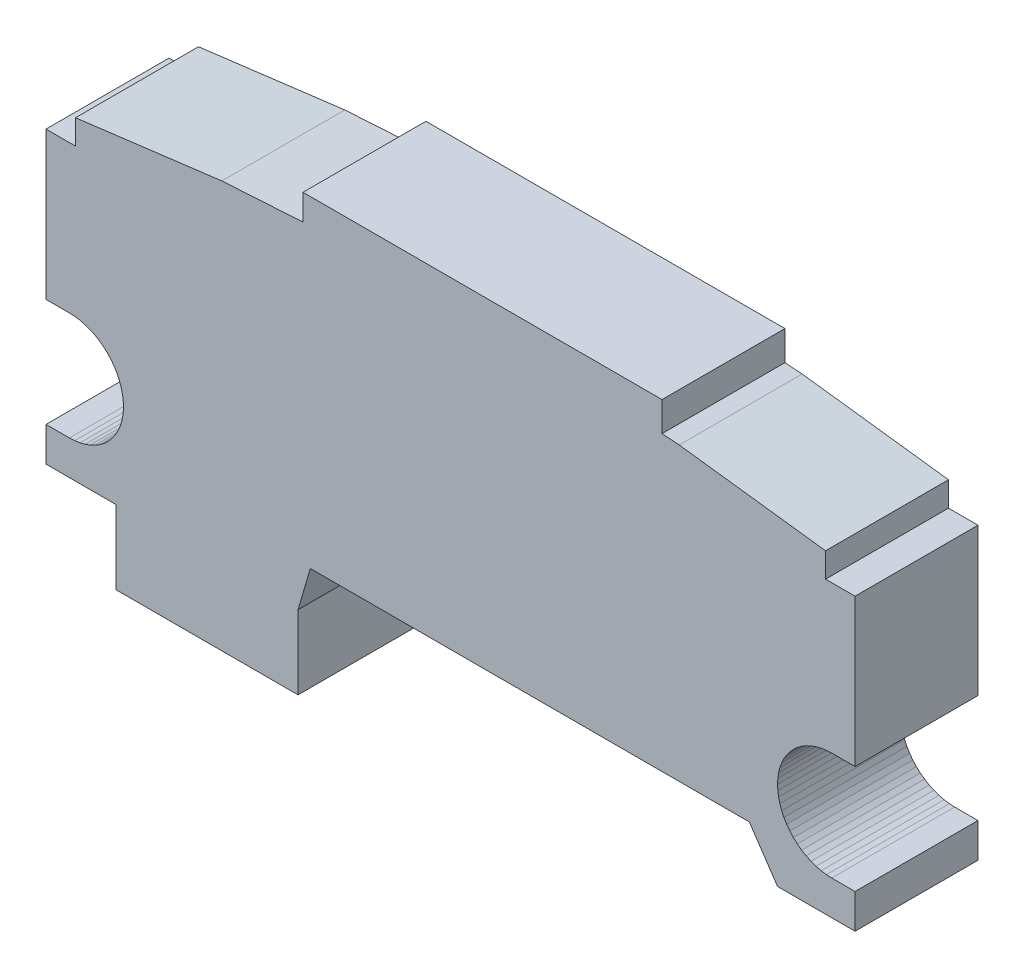
from build123d import *

# Parameters (mm, degrees)
COMPONENT_OUTLINE_DEPTH = 5


with BuildPart() as part:
    # 草图1 → Component_Outline (new body)
    with BuildSketch(Plane.XY):
        Polygon((-13.6, -10.7), (-13.6, -7.7), (-16.45, -7.7), (-16.45, -6.3), (-15.5, -6.3), (-15.2844, -6.2894), (-15.0708, -6.2577), (-14.8614, -6.2053), (-14.6581, -6.1325), (-14.4629, -6.0402), (-14.2778, -5.9292), (-14.1043, -5.8006), (-13.9444, -5.6556), (-13.7994, -5.4957), (-13.6708, -5.3223), (-13.5598, -5.1371), (-13.4675, -4.9419), (-13.3947, -4.7386), (-13.3423, -4.5292), (-13.3106, -4.3157), (-13.3, -4.1), (-13.3106, -3.8844), (-13.3423, -3.6708), (-13.3947, -3.4614), (-13.4675, -3.2581), (-13.5598, -3.0629), (-13.6708, -2.8777), (-13.7994, -2.7043), (-13.9444, -2.5444), (-14.1043, -2.3994), (-14.2778, -2.2708), (-14.4629, -2.1598), (-14.6581, -2.0675), (-14.8614, -1.9947), (-15.0708, -1.9423), (-15.2844, -1.9106), (-15.5, -1.9), (-16.45, -1.9), (-16.45, 4.1), (-15.25, 4.1), (-15.25, 5.1), (-9.3, 5.85), (-6, 6.05), (-6, 7.1), (8.6, 7.1), (8.6, 5.9), (9.3, 5.85), (15.25, 5.1), (15.25, 4.1), (16.45, 4.1), (16.45, -1.9), (15.5, -1.9), (15.2844, -1.9106), (15.0708, -1.9423), (14.8614, -1.9947), (14.6581, -2.0675), (14.4629, -2.1598), (14.2778, -2.2708), (14.1043, -2.3994), (13.9444, -2.5444), (13.7994, -2.7043), (13.6708, -2.8777), (13.5598, -3.0629), (13.4675, -3.2581), (13.3947, -3.4614), (13.3423, -3.6708), (13.3106, -3.8844), (13.3, -4.1), (13.3106, -4.3157), (13.3423, -4.5292), (13.3947, -4.7386), (13.4675, -4.9419), (13.5598, -5.1371), (13.6708, -5.3223), (13.7994, -5.4957), (13.9444, -5.6556), (14.1043, -5.8006), (14.2778, -5.9292), (14.4629, -6.0402), (14.6581, -6.1325), (14.8614, -6.2053), (15.0708, -6.2577), (15.2844, -6.2894), (15.5, -6.3), (16.45, -6.3), (16.45, -7.7), (13.3, -7.7), (12.15, -6), (-5.7, -6), (-6.2, -7.7), (-6.2, -10.7), align=None)
    extrude(amount=COMPONENT_OUTLINE_DEPTH)


solid = part.part
